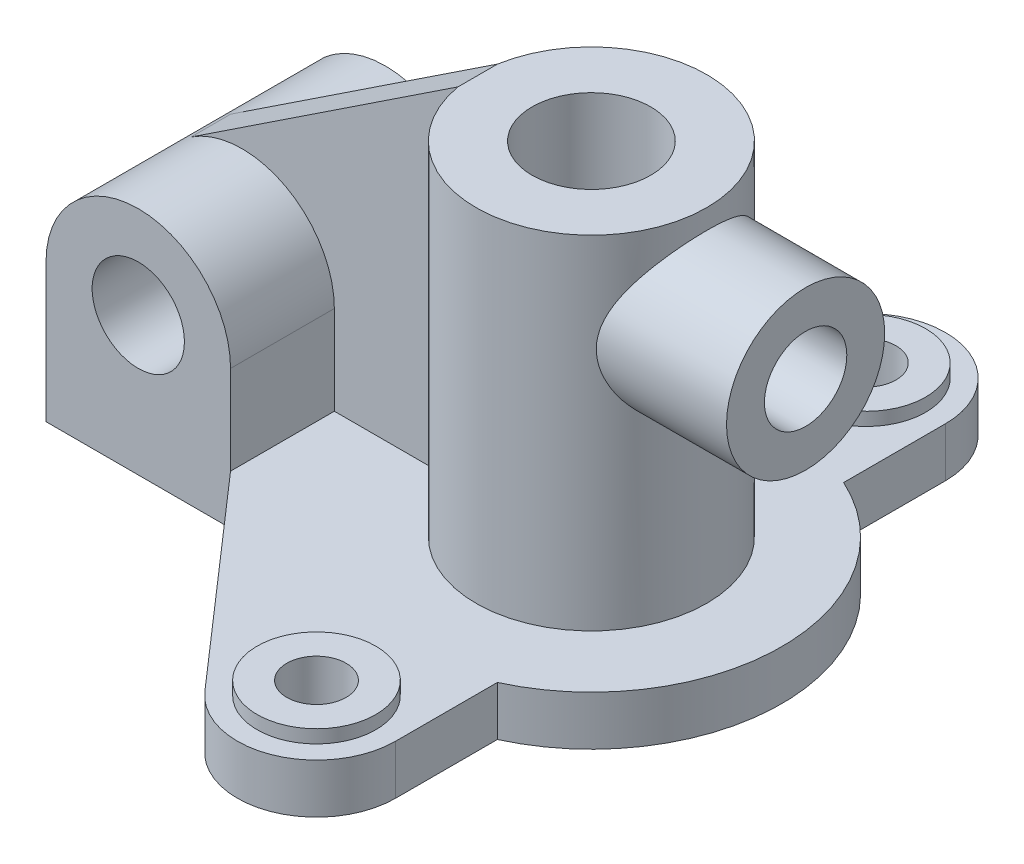
from build123d import *

# Parameters (mm, degrees)
BOSS_EXTRUDE1_DEPTH  = 381
SKETCH2_R            = 889
BOSS_EXTRUDE2_DEPTH  = 3022.6
SKETCH4_R            = 457.2
SKETCH4_R_2          = 228.6
BOSS_EXTRUDE3_DEPTH  = 482.6
CUT_EXTRUDE2_REACH   = 4217.201
SKETCH5_R            = 228.6
SKETCH6_R            = 609.6
BOSS_EXTRUDE4_DEPTH  = 1651
SKETCH7_R            = 317.5
CUT_EXTRUDE3_DEPTH   = 1651
SKETCH8_R            = 457.2
CUT_EXTRUDE4_DEPTH   = 3022.6
SKETCH10_W           = 1422.4
SKETCH10_H           = 1905
BOSS_EXTRUDE5_DEPTH  = 1778
CUT_EXTRUDE5_REACH   = 5768.893
CUT_EXTRUDE6_REACH   = 5768.893
SKETCH12_R           = 355.6
BOSS_EXTRUDE10_START = -3022.6
BOSS_EXTRUDE10_DEPTH = 3022.6
CUT_EXTRUDE7_REACH   = 5294.134


with BuildPart() as part:
    # Sketch1 → Boss-Extrude1 (new body)
    with BuildSketch(Plane(origin=(0, 0, 0), x_dir=(1, 0, 0), z_dir=(0, 1, 0))):
        with BuildLine():
            Line((609.6, 2119.019260313), (609.6, 1334.359757456))
            ThreePointArc((609.6, 1334.359757456), (1467.013334063, 0), (609.6, -1334.359757456))
            Line((609.6, -1334.359757456), (609.6, -2119.019260313))
            ThreePointArc((609.6, -2119.019260313), (214.2143917, -2689.741920095), (-459.049456656, -2520.124927618))
            Line((-459.049456656, -2520.124927618), (-1828.8, -952.5))
            Line((-1828.8, -952.5), (-1828.8, 952.5))
            Line((-1828.8, 952.5), (-459.049456656, 2520.124927618))
            ThreePointArc((-459.049456656, 2520.124927618), (214.2143917, 2689.741920095), (609.6, 2119.019260313))
        make_face()
    extrude(amount=BOSS_EXTRUDE1_DEPTH)

    # Sketch2 → Boss-Extrude2 (add)
    with BuildSketch(Plane(origin=(0, 0, 0), x_dir=(1, 0, 0), z_dir=(0, 1, 0))):
        with Locations(Location((0, 0, 0), (0, 0, 270))):
            Circle(SKETCH2_R)
    extrude(amount=BOSS_EXTRUDE2_DEPTH)

    # Sketch4 → Boss-Extrude3 (add)
    # profile 1 of 2: a face of its own
    with BuildSketch(Plane(origin=(0, 0, 0), x_dir=(1, 0, 0), z_dir=(0, 1, 0))):
        with Locations(Location((0, -2119.019260313, 0), (0, 0, 90))):
            Circle(SKETCH4_R)
        with Locations(Location((0, -2119.019260313, 0), (0, 0, 90))):
            Circle(SKETCH4_R_2, mode=Mode.SUBTRACT)
    # profile 2 of 2: a face of its own
    with BuildSketch(Plane(origin=(0, 0, 0), x_dir=(1, 0, 0), z_dir=(0, 1, 0))):
        with Locations(Location((0, 2119.019260313, 0), (0, 0, 90))):
            Circle(SKETCH4_R)
        with Locations(Location((0, 2119.019260313, 0), (0, 0, 90))):
            Circle(SKETCH4_R_2, mode=Mode.SUBTRACT)
    extrude(amount=BOSS_EXTRUDE3_DEPTH)

    # Sketch5 → Cut-Extrude2 (cut, up to next)
    with BuildSketch(Plane(origin=(0, 381, 0), x_dir=(1, 0, 0), z_dir=(0, 1, 0)), mode=Mode.PRIVATE) as cut_extrude2_sk1:
        with Locations(Location((0, 2119.019260313, 0), (0, 0, 90))):
            Circle(SKETCH5_R)
    cut_extrude2_tool1 = extrude(cut_extrude2_sk1.sketch, amount=-CUT_EXTRUDE2_REACH, mode=Mode.PRIVATE) & part.part
    # Sketch5 → Cut-Extrude2 (cut, up to next)
    with BuildSketch(Plane(origin=(0, 381, 0), x_dir=(1, 0, 0), z_dir=(0, 1, 0)), mode=Mode.PRIVATE) as cut_extrude2_sk2:
        with Locations(Location((0, -2119.019260313, 0), (0, 0, 90))):
            Circle(SKETCH5_R)
    cut_extrude2_tool2 = extrude(cut_extrude2_sk2.sketch, amount=-CUT_EXTRUDE2_REACH, mode=Mode.PRIVATE) & part.part
    add(cut_extrude2_tool1.solids().sort_by_distance((0, 381, -2119.01926))[0], mode=Mode.SUBTRACT)
    add(cut_extrude2_tool2.solids().sort_by_distance((0, 381, 2119.01926))[0], mode=Mode.SUBTRACT)

    # Sketch6 → Boss-Extrude4 (add)
    with BuildSketch(Plane(origin=(0, 0, 0), x_dir=(0, 0, -1), z_dir=(1, 0, 0))):
        with Locations(Location((0, 2260.6, 0), (0, 0, 180))):
            Circle(SKETCH6_R)
    extrude(amount=BOSS_EXTRUDE4_DEPTH)

    # Sketch7 → Cut-Extrude3 (cut)
    with BuildSketch(Plane(origin=(1651, 0, 0), x_dir=(0, 0, -1), z_dir=(1, 0, 0))):
        with Locations((0, 2260.6)):
            Circle(SKETCH7_R)
    extrude(amount=-CUT_EXTRUDE3_DEPTH, mode=Mode.SUBTRACT)

    # Sketch8 → Cut-Extrude4 (cut)
    with BuildSketch(Plane(origin=(0, 3022.6, 0), x_dir=(1, 0, 0), z_dir=(0, 1, 0))):
        with Locations(Location((0, 0, 0), (0, 0, 270))):
            Circle(SKETCH8_R)
    extrude(amount=-CUT_EXTRUDE4_DEPTH, mode=Mode.SUBTRACT)

    # Sketch10 → Boss-Extrude5 (add)
    with BuildSketch(Plane(origin=(0, 0, 0), x_dir=(1, 0, 0), z_dir=(0, 1, 0))):
        with Locations((-2540, 0)):
            Rectangle(SKETCH10_W, SKETCH10_H)
    extrude(amount=BOSS_EXTRUDE5_DEPTH)

    # Sketch11 → Cut-Extrude5 (cut, up to next)
    with BuildSketch(Plane.XY.offset(952.5), mode=Mode.PRIVATE) as cut_extrude5_sk1:
        with BuildLine():
            Line((-3251.2, 1778), (-3251.2, 1066.8))
            ThreePointArc((-3251.2, 1066.8), (-3042.89434278, 1569.69434278), (-2540, 1778))
            Line((-2540, 1778), (-3251.2, 1778))
        make_face()
    cut_extrude5_tool1 = extrude(cut_extrude5_sk1.sketch, amount=-CUT_EXTRUDE5_REACH, mode=Mode.PRIVATE) & part.part
    # Sketch11 → Cut-Extrude5 (cut, up to next)
    with BuildSketch(Plane.XY.offset(952.5), mode=Mode.PRIVATE) as cut_extrude5_sk2:
        with BuildLine():
            Line((-1828.8, 1778), (-2540, 1778))
            ThreePointArc((-2540, 1778), (-2037.10565722, 1569.69434278), (-1828.8, 1066.8))
            Line((-1828.8, 1066.8), (-1828.8, 1778))
        make_face()
    cut_extrude5_tool2 = extrude(cut_extrude5_sk2.sketch, amount=-CUT_EXTRUDE5_REACH, mode=Mode.PRIVATE) & part.part
    add(cut_extrude5_tool1.solids().sort_by_distance((-3092.340722, 1619.140722, 952.5))[0], mode=Mode.SUBTRACT)
    add(cut_extrude5_tool2.solids().sort_by_distance((-1987.659278, 1619.140722, 952.5))[0], mode=Mode.SUBTRACT)

    # Sketch12 → Cut-Extrude6 (cut, up to next)
    with BuildSketch(Plane.XY.offset(952.5), mode=Mode.PRIVATE) as cut_extrude6_sk1:
        with Locations((-2540, 1066.8)):
            Circle(SKETCH12_R)
    cut_extrude6_tool1 = extrude(cut_extrude6_sk1.sketch, amount=-CUT_EXTRUDE6_REACH, mode=Mode.PRIVATE) & part.part
    add(cut_extrude6_tool1.solids().sort_by_distance((-2540, 1066.8, 952.5))[0], mode=Mode.SUBTRACT)

    # Sketch15 → Boss-Extrude10 (add)
    with BuildSketch(Plane(origin=(0, 3022.6, 0), x_dir=(1, 0, 0), z_dir=(0, 1, 0)).offset(BOSS_EXTRUDE10_START)):
        with BuildLine():
            Line((-875.839734198, 152.4), (-3251.2, 152.4))
            Line((-3251.2, 152.4), (-3251.2, -152.4))
            Line((-3251.2, -152.4), (-875.839734198, -152.4))
            ThreePointArc((-875.839734198, -152.4), (-889, 0), (-875.839734198, 152.4))
        make_face()
    extrude(amount=BOSS_EXTRUDE10_DEPTH)

    # Sketch16 → Cut-Extrude7 (cut, up to next)
    with BuildSketch(Plane.XY.offset(152.4), mode=Mode.PRIVATE) as cut_extrude7_sk1:
        with BuildLine():
            Line((-875.839734198, 3022.6), (-2932.826520859, 1659.668252236))
            ThreePointArc((-2932.826520859, 1659.668252236), (-3166.571488992, 1403.272300765), (-3251.2, 1066.8))
            Line((-3251.2, 1066.8), (-3251.2, 3022.6))
            Line((-3251.2, 3022.6), (-875.839734198, 3022.6))
        make_face()
    cut_extrude7_tool1 = extrude(cut_extrude7_sk1.sketch, amount=-CUT_EXTRUDE7_REACH, mode=Mode.PRIVATE) & part.part
    add(cut_extrude7_tool1.solids().sort_by_distance((-2467.984815, 2485.152137, 152.4))[0], mode=Mode.SUBTRACT)


solid = part.part
